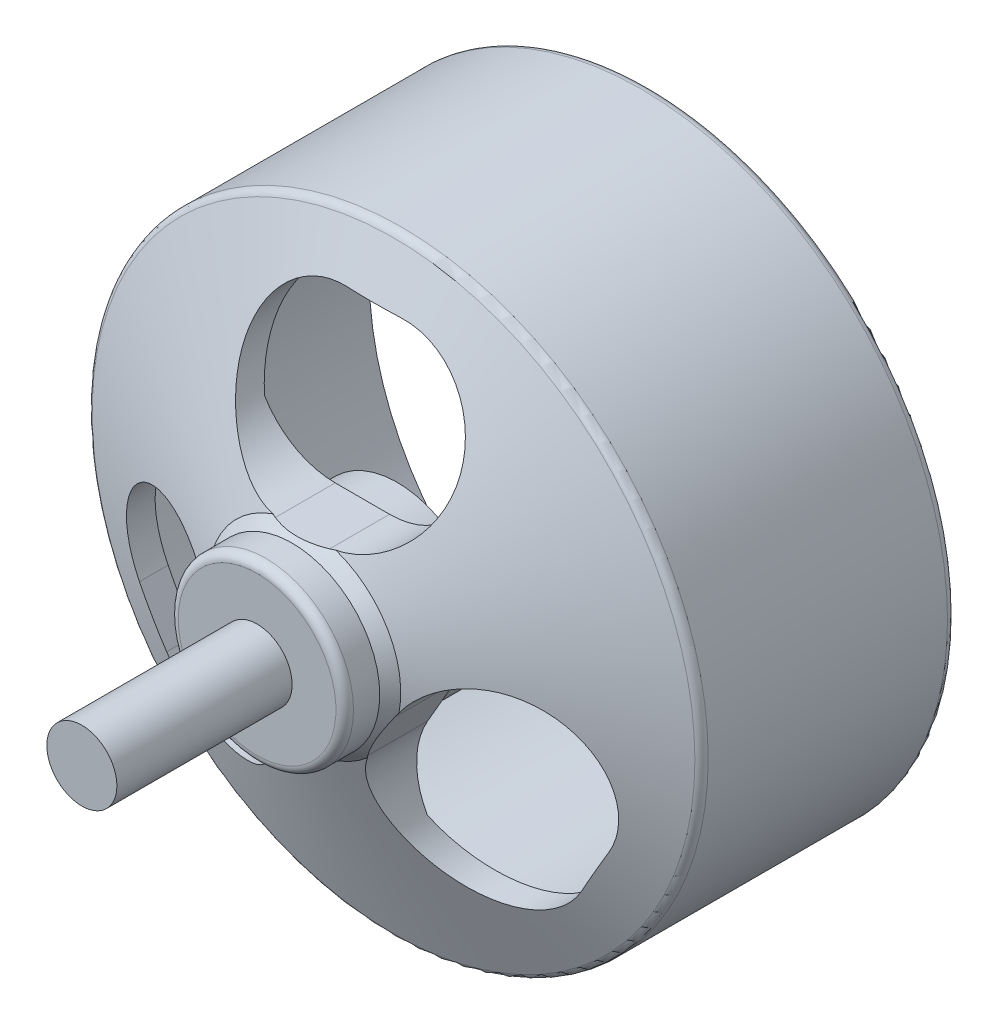
from build123d import *

# Parameters (mm, degrees)
CUT_EXTRUDE_1_DEPTH      = 10
PATTERN_CIRCULAR_1_COUNT = 3
FILLET_1_R               = 0.5
SCALE_1_SCALE            = 0.5


with BuildPart() as part:
    # Эскиз1 → Повернуть1 (revolve)
    with BuildSketch(Plane(origin=(0, 0, 0), x_dir=(0, 0, -1), z_dir=(1, 0, 0)), mode=Mode.PRIVATE) as revolve_1_sk:
        Polygon((-9, 0), (-9, 2), (1, 2), (1, 5), (3, 5), (3.7, 5.5), (8.916460066, 17.5), (23.4, 17.5), (23.4, 16), (9.9, 16), (7.009211714, 9.35), (7.009211714, 5), (9, 5), (9, 0), align=None)
    revolve(revolve_1_sk.sketch.rotate(Axis((0, 0, -9), (0, 0, -1)), 90), axis=Axis((0, 0, -9), (0, 0, -1)))

    # Эскиз2 → Вырез-Вытянуть1 (cut)
    with BuildSketch(Plane.XY.offset(-1)):
        with BuildLine():
            Line((1.55, 14.5641447), (-1.55, 14.5641447))
            ThreePointArc((-1.55, 14.5641447), (-6.235, 9.8791447), (-1.55, 5.1941447))
            Line((-1.55, 5.1941447), (1.55, 5.1941447))
            ThreePointArc((1.55, 5.1941447), (6.235, 9.8791447), (1.55, 14.5641447))
        make_face()
    cut_extrude_1 = extrude(amount=-CUT_EXTRUDE_1_DEPTH, mode=Mode.SUBTRACT)

    # Круговой массив1: Вырез-Вытянуть1 ×3 about axis
    pattern_circular_1_axis = Axis((0, 0, 0), (0, 0, 1))
    for i in range(1, PATTERN_CIRCULAR_1_COUNT):
        add(cut_extrude_1.rotate(pattern_circular_1_axis, i * 360 / PATTERN_CIRCULAR_1_COUNT), mode=Mode.SUBTRACT)

    # Скругление1
    fillet_1_edges = [part.edges().sort_by_distance(p)[0] for p in [
        (-17.5, 0, -23.4),
        (-17.5, 0, -8.916460066),
        (-5, 0, -1),
    ]]
    fillet(fillet_1_edges, radius=FILLET_1_R)


with BuildPart() as part_1:
    # Масштаб1: scaled about (3.2e-07, -3.26e-07, -11.771980124)
    add(part.part.scale(SCALE_1_SCALE).moved(Location((1.6e-07, -1.63e-07, -5.885990062))))


solid = part_1.part
